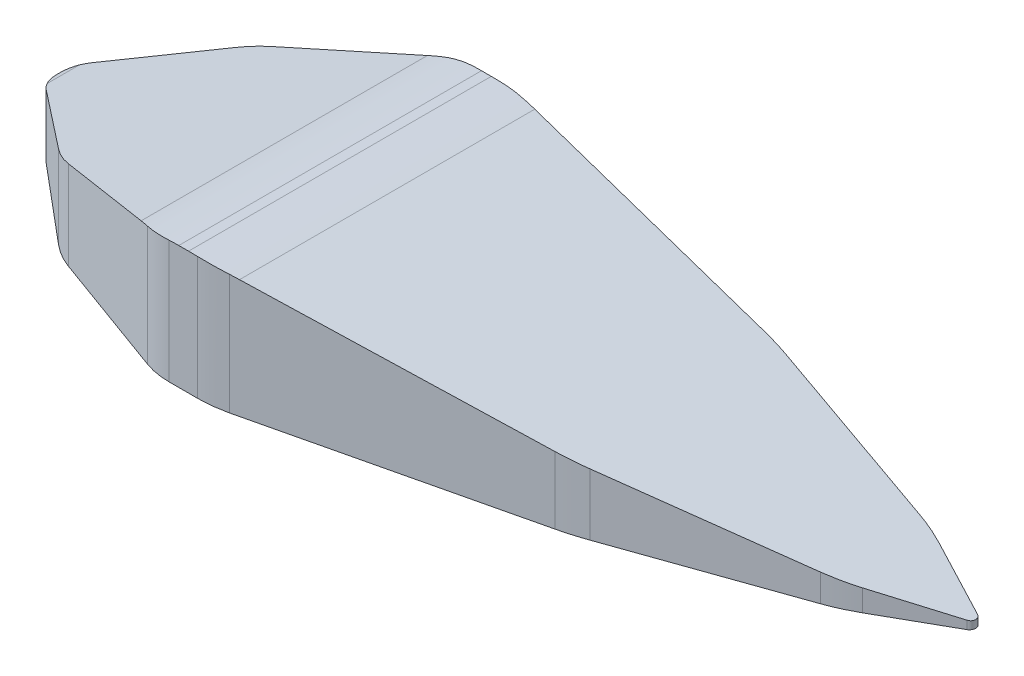
from build123d import *

# Parameters (mm, degrees)
TOPVIEW_EXTRUDE_DEPTH      = 800
SIDEPROFILE_CUT_DEPTH      = 5065.329373382
SIDEPROFILE_CUT_DEPTH_BACK = 5065.329373382
SKETCH2_OUTSIDE_W          = 5882.814
SKETCH2_OUTSIDE_H          = 1835.392


with BuildPart() as part:
    # Sketch1 → TopView_Extrude (new body)
    with BuildSketch(Plane(origin=(0, 0, 0), x_dir=(1, 0, 0), z_dir=(0, 1, 0))):
        with BuildLine():
            Line((146.069849076, 122.567124227), (556.148324977, 466.663731547))
            ThreePointArc((556.148324977, 466.663731547), (613.263316637, 506.656075273), (676.455195963, 536.122941687))
            Line((676.455195963, 536.122941687), (1335.173700718, 775.877020708))
            ThreePointArc((1335.173700718, 775.877020708), (1402.522523085, 793.923094197), (1471.981833896, 800))
            Line((1471.981833896, 800), (1622.74932188, 800))
            ThreePointArc((1622.74932188, 800), (1701.208389168, 796.917335971), (1779.183730567, 787.688349521))
            Line((1779.183730567, 787.688349521), (3265.383087903, 552.297583021))
            ThreePointArc((3265.383087903, 552.297583021), (3342.599008928, 537.986460302), (3418.960120906, 519.653777172))
            Line((3418.960120906, 519.653777172), (4378.134590748, 262.643696963))
            ThreePointArc((4378.134590748, 262.643696963), (4461.335543574, 236.410539363), (4541.933526436, 203.025778355))
            Line((4541.933526436, 203.025778355), (4919.016455083, 27.18923681))
            ThreePointArc((4919.016455083, 27.18923681), (4936.337914092, 0), (4919.016455083, -27.18923681))
            Line((4919.016455083, -27.18923681), (4541.933526436, -203.025778355))
            ThreePointArc((4541.933526436, -203.025778355), (4461.335543574, -236.410539363), (4378.134590748, -262.643696963))
            Line((4378.134590748, -262.643696963), (3418.960120906, -519.653777172))
            ThreePointArc((3418.960120906, -519.653777172), (3342.599008928, -537.986460302), (3265.383087903, -552.297583021))
            Line((3265.383087903, -552.297583021), (1779.183730567, -787.688349521))
            ThreePointArc((1779.183730567, -787.688349521), (1701.208389168, -796.917335971), (1622.74932188, -800))
            Line((1622.74932188, -800), (1471.981833896, -800))
            ThreePointArc((1471.981833896, -800), (1402.522523085, -793.923094197), (1335.173700718, -775.877020708))
            Line((1335.173700718, -775.877020708), (676.455195963, -536.122941687))
            ThreePointArc((676.455195963, -536.122941687), (613.263316637, -506.656075273), (556.148324977, -466.663731547))
            Line((556.148324977, -466.663731547), (146.069849076, -122.567124227))
            ThreePointArc((146.069849076, -122.567124227), (88.915850742, 0), (146.069849076, 122.567124227))
        make_face()
    extrude(amount=TOPVIEW_EXTRUDE_DEPTH)

    # Sketch2 outside → SideProfile_Cut (cut, two sides: drawn at the far end of the back side and taken through both)
    with BuildSketch(Plane.XY.offset(-SIDEPROFILE_CUT_DEPTH_BACK)):
        with Locations((2512.627, 400)):
            Rectangle(SKETCH2_OUTSIDE_W, SKETCH2_OUTSIDE_H)
        with BuildLine():
            Line((0, 300), (0, 332.854125267))
            ThreePointArc((0, 332.854125267), (31.780430043, 425.180358155), (113.65511039, 478.384359237))
            Line((113.65511039, 478.384359237), (1282.133703367, 770.201559797))
            ThreePointArc((1282.133703367, 770.201559797), (1402.370605908, 792.522432945), (1524.432967436, 800))
            Line((1524.432967436, 800), (1576.231046196, 800))
            ThreePointArc((1576.231046196, 800), (1701.206287536, 796.091478127), (1825.693060411, 784.381189052))
            Line((1825.693060411, 784.381189052), (4977.324, 388.181))
            Line((4977.324, 388.181), (4977.324, 355.91))
            Line((4977.324, 355.91), (1795.457321969, 155.908910924))
            ThreePointArc((1795.457321969, 155.908910924), (1701.40460764, 151.477591611), (1607.259154289, 150))
            Line((1607.259154289, 150), (150, 150))
            ThreePointArc((150, 150), (43.933982822, 193.933982822), (0, 300))
        make_face(mode=Mode.SUBTRACT)
    extrude(amount=SIDEPROFILE_CUT_DEPTH + SIDEPROFILE_CUT_DEPTH_BACK, mode=Mode.SUBTRACT)


solid = part.part
